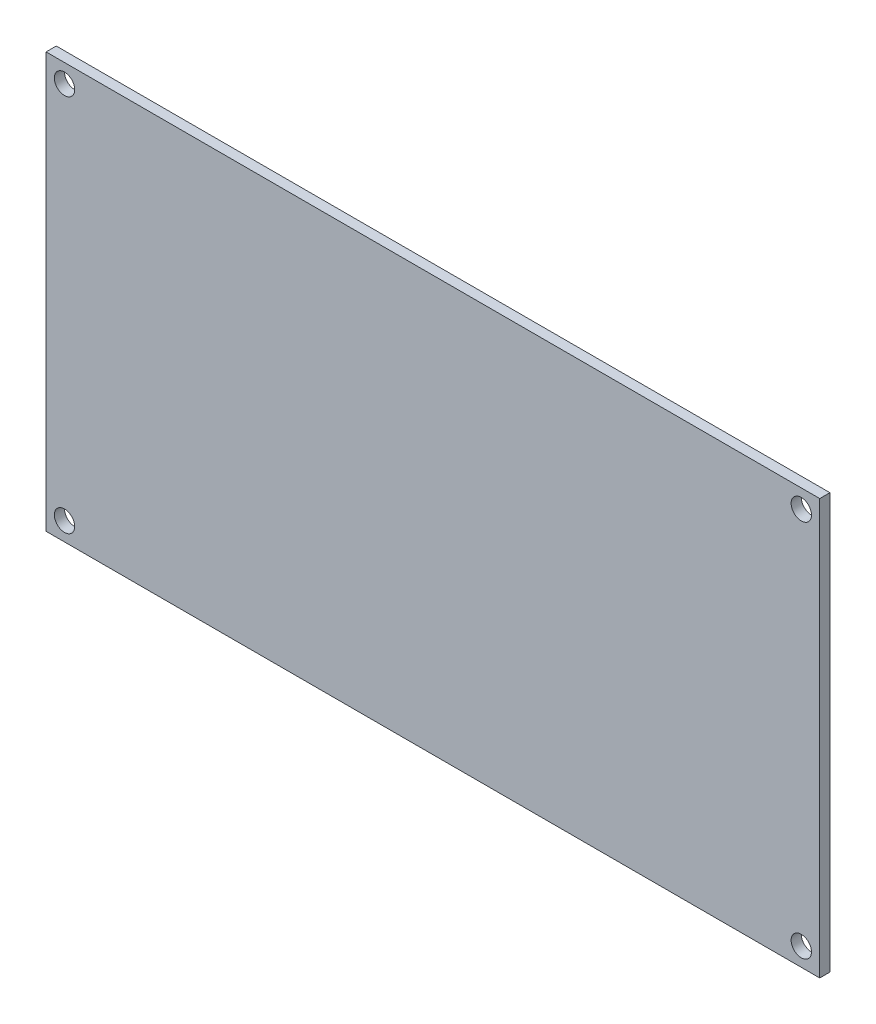
from build123d import *

# Parameters (mm, degrees)
ESQUISSE1_W        = 151.93976922
ESQUISSE1_H        = 81.544216856
ESQUISSE1_R        = 2
BOSS_EXTRU_1_DEPTH = 2


with BuildPart() as part:
    # Esquisse1 → Boss.-Extru.1 (new body)
    with BuildSketch(Plane.XY):
        with Locations((-43.862390942, -0.866617279)):
            Rectangle(ESQUISSE1_W, ESQUISSE1_H)
        with Locations((-116.210955208, 36.284170806)):
            Circle(ESQUISSE1_R, mode=Mode.SUBTRACT)
        with Locations((-116.210955208, -38.017405363)):
            Circle(ESQUISSE1_R, mode=Mode.SUBTRACT)
        with Locations((28.486173324, -38.017405363)):
            Circle(ESQUISSE1_R, mode=Mode.SUBTRACT)
        with Locations((28.486173324, 36.284170806)):
            Circle(ESQUISSE1_R, mode=Mode.SUBTRACT)
    extrude(amount=BOSS_EXTRU_1_DEPTH)


solid = part.part
